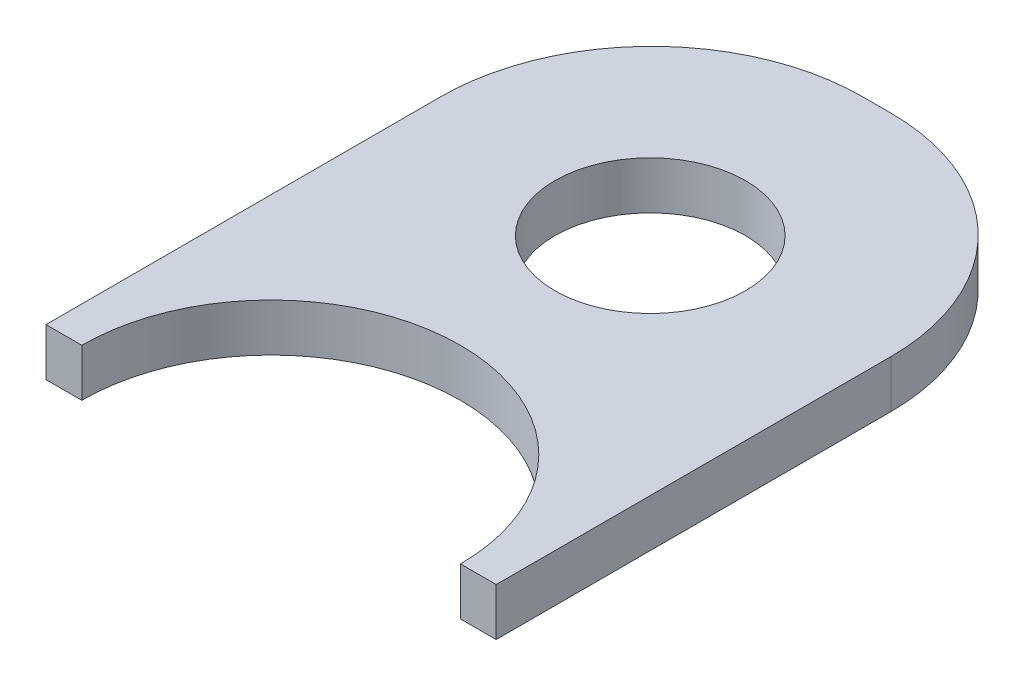
from build123d import *

# Parameters (mm, degrees)
SKETCH1_R           = 8
BOSS_EXTRUDE1_DEPTH = 4


with BuildPart() as part:
    # Sketch1 → Boss-Extrude1 (new body)
    with BuildSketch(Plane(origin=(0, 0, 0), x_dir=(1, 0, 0), z_dir=(0, 1, 0))):
        with BuildLine():
            Line((0, 0), (-3, 0))
            ThreePointArc((-3, 0), (-18.88, 15.88), (-34.76, 0))
            Line((-34.76, 0), (-37.76, 0))
            Line((-37.76, 0), (-37.76, 33.101))
            ThreePointArc((-37.76, 33.101), (-32.57608292, 45.61608292), (-20.061, 50.8))
            Line((-20.061, 50.8), (-17.699, 50.8))
            ThreePointArc((-17.699, 50.8), (-5.18391708, 45.61608292), (0, 33.101))
            Line((0, 33.101), (0, 0))
        make_face()
        with Locations((-18.88, 31.8)):
            Circle(SKETCH1_R, mode=Mode.SUBTRACT)
    extrude(amount=BOSS_EXTRUDE1_DEPTH)


solid = part.part
